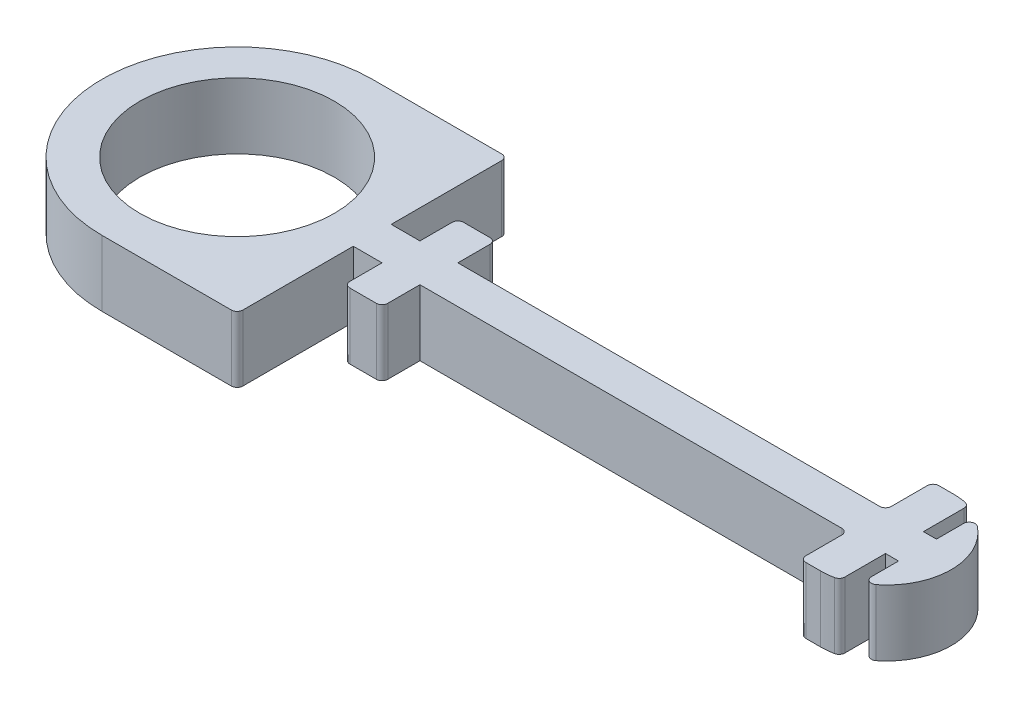
from build123d import *

# Parameters (mm, degrees)
SKETCH1_R           = 12.7
BOSS_EXTRUDE1_DEPTH = 8.6
FILLET2_R           = 0.75


with BuildPart() as part:
    # Sketch1 → Boss-Extrude1 (new body)
    with BuildSketch(Plane(origin=(0, 0, 0), x_dir=(1, 0, 0), z_dir=(0, 1, 0))):
        with BuildLine():
            Line((88.844407291, -2.475), (88.844407291, -7.400365603))
            ThreePointArc((88.844407291, -7.400365603), (93.263798172, 0), (88.844407291, 7.400365603))
            Line((88.844407291, 7.400365603), (88.844407291, 2.475))
            Line((88.844407291, 2.475), (87.144407291, 2.475))
            Line((87.144407291, 2.475), (87.144407291, 8.377664326))
            ThreePointArc((87.144407291, 8.377664326), (86.01145531, 8.60710798), (84.85806661, 8.684043601))
            Line((84.85806661, 8.684043601), (82.194407291, 8.684043601))
            Line((82.194407291, 8.684043601), (82.194407291, 2.475))
            Line((82.194407291, 2.475), (26.35, 2.475))
            Line((26.35, 2.475), (26.35, 7.425))
            Line((26.35, 7.425), (21.4, 7.425))
            Line((21.4, 7.425), (21.4, 2.475))
            Line((21.4, 2.475), (17.65, 2.475))
            Line((17.65, 2.475), (17.65, 17.65))
            Line((17.65, 17.65), (0, 17.65))
            ThreePointArc((0, 17.65), (-17.65, 0), (0, -17.65))
            Line((0, -17.65), (17.65, -17.65))
            Line((17.65, -17.65), (17.65, -2.475))
            Line((17.65, -2.475), (21.4, -2.475))
            Line((21.4, -2.475), (21.4, -7.425))
            Line((21.4, -7.425), (26.35, -7.425))
            Line((26.35, -7.425), (26.35, -2.475))
            Line((26.35, -2.475), (82.194407291, -2.475))
            Line((82.194407291, -2.475), (82.194407291, -8.684043601))
            Line((82.194407291, -8.684043601), (84.85806661, -8.684043601))
            ThreePointArc((84.85806661, -8.684043601), (86.01145531, -8.60710798), (87.144407291, -8.377664326))
            Line((87.144407291, -8.377664326), (87.144407291, -2.475))
            Line((87.144407291, -2.475), (88.844407291, -2.475))
        make_face()
        with Locations(Location((0, 0, 0), (0, 0, 90))):
            Circle(SKETCH1_R, mode=Mode.SUBTRACT)
    extrude(amount=BOSS_EXTRUDE1_DEPTH)

    # Fillet2
    fillet2_edges = [part.edges().sort_by_distance(p)[0] for p in [
        (21.4, 4.3, -7.425),
        (26.35, 4.3, -7.425),
        (82.194407291, 4.3, -2.475),
        (82.194407291, 4.3, -8.684043601),
        (87.144407291, 4.3, -8.377664326),
        (88.844407291, 4.3, -7.400365603),
        (88.844407291, 4.3, 7.400365603),
        (87.144407291, 4.3, 8.377664326),
        (82.194407291, 4.3, 8.684043601),
        (82.194407291, 4.3, 2.475),
        (26.35, 4.3, 7.425),
        (21.4, 4.3, 7.425),
        (17.65, 4.3, 17.65),
        (17.65, 4.3, -17.65),
    ]]
    fillet(fillet2_edges, radius=FILLET2_R)


solid = part.part
